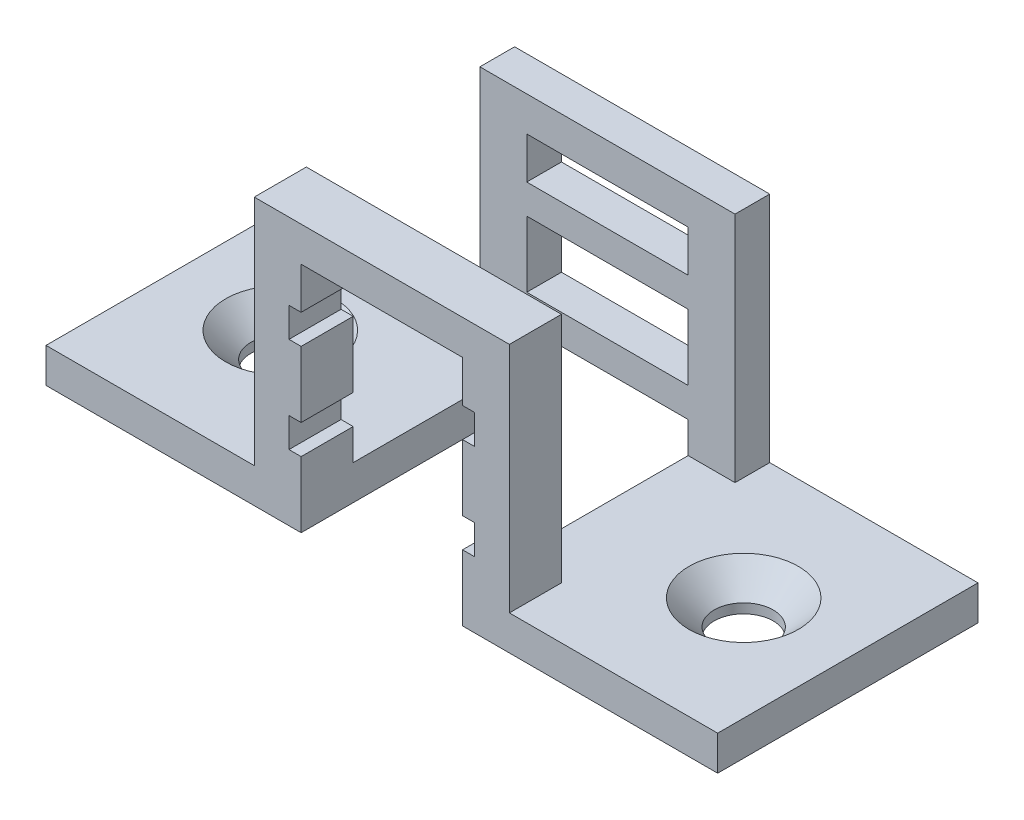
from build123d import *

# Parameters (mm, degrees)
SKETCH1_W                = 14.7
SKETCH1_H                = 15
BOSS_EXTRUDE1_DEPTH      = 15.4
SKETCH2_W                = 10.7
SKETCH2_H                = 14.684086862
CUT_EXTRUDE1_DEPTH       = 13
SKETCH4_W                = 2.7
SKETCH4_H                = 3.8
BOSS_EXTRUDE2_DEPTH      = 3
SKETCH5_W                = 10
SKETCH5_H                = 13.4
CUT_EXTRUDE2_DEPTH       = 23.572106681
SKETCH6_W                = 9.3
SKETCH6_H                = 3.8
SKETCH6_H_2              = 2.4
CUT_EXTRUDE3_DEPTH       = 23.719650085
BOSS_EXTRUDE3_DEPTH      = 12
BOSS_EXTRUDE3_DEPTH_BACK = 2.7
SKETCH7_W                = 15
SKETCH7_H                = 2
BOSS_EXTRUDE4_DEPTH      = 12
BOSS_EXTRUDE4_DEPTH_BACK = 2.7
SKETCH8_W                = 15
SKETCH8_H                = 2


with BuildPart() as part:
    # Sketch1 → Boss-Extrude1 (new body)
    with BuildSketch(Plane(origin=(0, 0, 0), x_dir=(1, 0, 0), z_dir=(0, 1, 0))):
        Rectangle(SKETCH1_W, SKETCH1_H)
    extrude(amount=BOSS_EXTRUDE1_DEPTH)

    # Sketch2 → Cut-Extrude1 (cut)
    with BuildSketch(Plane.XY.offset(7.5)):
        with Locations((0, 6.057956569)):
            Rectangle(SKETCH2_W, SKETCH2_H)
    extrude(amount=-CUT_EXTRUDE1_DEPTH, mode=Mode.SUBTRACT)

    # Sketch4 → Boss-Extrude2 (add)
    with BuildSketch(Plane.XY.offset(7.5)):
        with Locations((-6, 7.4)):
            Rectangle(SKETCH4_W, SKETCH4_H)
        with Locations((-6, 12.9)):
            Rectangle(SKETCH4_W, SKETCH4_H)
        with Locations((6, 12.9)):
            Rectangle(SKETCH4_W, SKETCH4_H)
        with Locations((6, 7.4)):
            Rectangle(SKETCH4_W, SKETCH4_H)
        with Locations((-6, 1.9)):
            Rectangle(SKETCH4_W, SKETCH4_H)
        with Locations((6, 1.9)):
            Rectangle(SKETCH4_W, SKETCH4_H)
    extrude(amount=-BOSS_EXTRUDE2_DEPTH)

    # Sketch5 → Cut-Extrude2 (cut, through all)
    with BuildSketch(Plane(origin=(7.35, 0, 0), x_dir=(0, 0, -1), z_dir=(1, 0, 0))):
        with Locations((0.5, 8.7)):
            Rectangle(SKETCH5_W, SKETCH5_H)
    extrude(amount=-CUT_EXTRUDE2_DEPTH, mode=Mode.SUBTRACT)

    # Sketch6 → Cut-Extrude3 (cut, through all)
    with BuildSketch(Plane.XY.offset(7.5)):
        with Locations((0, 7.4)):
            Rectangle(SKETCH6_W, SKETCH6_H)
        with Locations((0, 1.9)):
            Rectangle(SKETCH6_W, SKETCH6_H)
        with Locations((0, 12.2)):
            Rectangle(SKETCH6_W, SKETCH6_H_2)
    extrude(amount=-CUT_EXTRUDE3_DEPTH, mode=Mode.SUBTRACT)

    # Sketch7 → Boss-Extrude3 (add, two sides: drawn at the far end of the back side and taken through both)
    with BuildSketch(Plane.ZY.offset(7.35).offset(-BOSS_EXTRUDE3_DEPTH_BACK)):
        with Locations((0, 1)):
            Rectangle(SKETCH7_W, SKETCH7_H)
    extrude(amount=BOSS_EXTRUDE3_DEPTH + BOSS_EXTRUDE3_DEPTH_BACK)

    # Sketch8 → Boss-Extrude4 (add, two sides: drawn at the far end of the back side and taken through both)
    with BuildSketch(Plane(origin=(7.35, 0, 0), x_dir=(0, 0, -1), z_dir=(1, 0, 0)).offset(-BOSS_EXTRUDE4_DEPTH_BACK)):
        with Locations((0, 1)):
            Rectangle(SKETCH8_W, SKETCH8_H)
    extrude(amount=BOSS_EXTRUDE4_DEPTH + BOSS_EXTRUDE4_DEPTH_BACK)

    # Sketch10 → CSK for M3 Flat Head Machine Screw1 (revolve, cut)
    with BuildSketch(Plane(origin=(-13.35, 2, 0), x_dir=(0, 0, 1), z_dir=(1, 0, 0))):
        Polygon((0, 0), (0, 2), (1.7, 2), (1.7, 1.45), (3.15, 0), align=None)
    revolve(axis=Axis((-13.35, 8.35, 0), (0, -1, 0)), mode=Mode.SUBTRACT)

    # Sketch12 → CSK for M3 Flat Head Machine Screw2 (revolve, cut)
    with BuildSketch(Plane(origin=(13.35, 2, 0), x_dir=(0, 0, 1), z_dir=(1, 0, 0))):
        Polygon((0, 0), (0, 2), (1.7, 2), (1.7, 1.45), (3.15, 0), align=None)
    revolve(axis=Axis((13.35, 8.35, 0), (0, -1, 0)), mode=Mode.SUBTRACT)


solid = part.part
